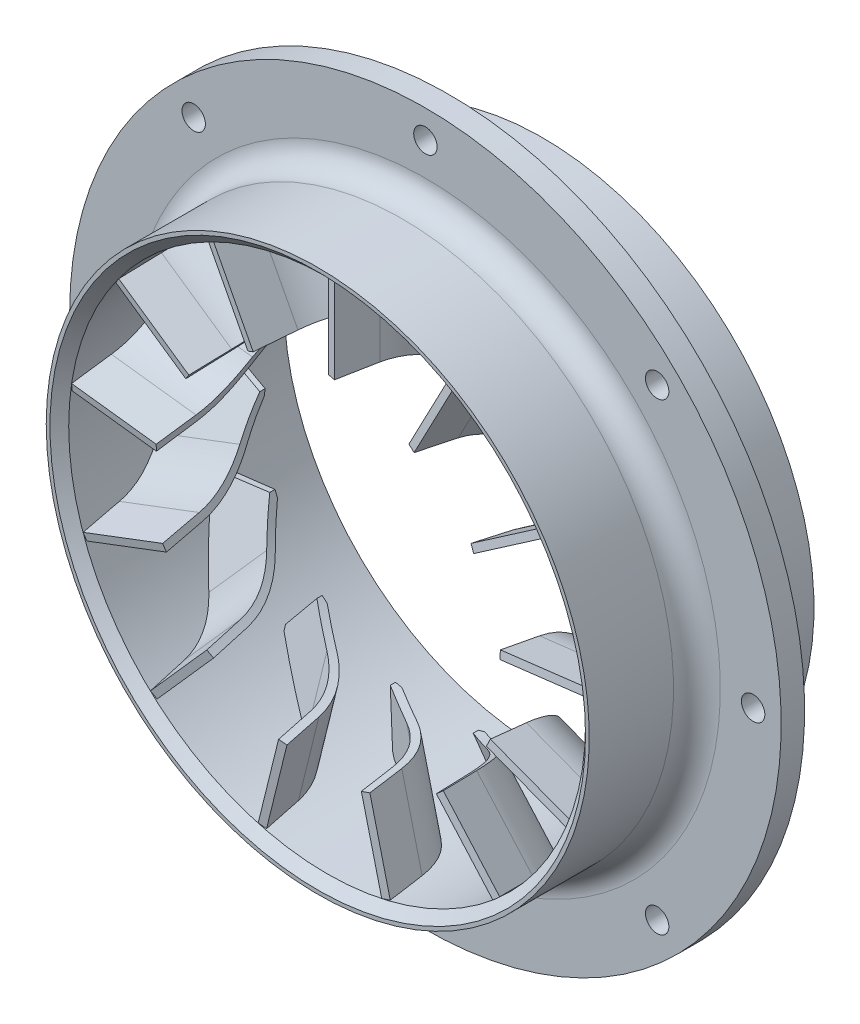
from build123d import *

# Parameters (mm, degrees)
CIRPATTERN1_COUNT = 8
FIN_REACH         = 60.856
FIN_END_RADIUS    = 27.6
FIN_CUT_DEPTH     = 59.855755878
CIRPATTERN5_COUNT = 13
CHAMFER1_SIZE     = 1


with BuildPart() as part:
    # Sketch1 → Revolve1 (revolve)
    with BuildSketch(Plane(origin=(0, 0, 0), x_dir=(0, 0, -1), z_dir=(1, 0, 0)), mode=Mode.PRIVATE) as revolve1_sk:
        with BuildLine():
            Line((-10, 29), (0, 29))
            Line((0, 29), (0, 27.6))
            Line((0, 27.6), (-24, 27.6))
            Line((-24, 27.6), (-24, 29))
            Line((-24, 29), (-15, 29))
            ThreePointArc((-15, 29), (-13.232233047, 29.732233047), (-12.5, 31.5))
            Line((-12.5, 31.5), (-12.5, 38))
            Line((-12.5, 38), (-10, 38))
            Line((-10, 38), (-10, 29))
        make_face()
    revolve(revolve1_sk.sketch.rotate(Axis((0, 0, 0), (0, 0, 1)), 90), axis=Axis((0, 0, 0), (0, 0, 1)))

    # Sketch2 → M3x0.5 Tapped Hole1 (revolve, cut)
    with BuildSketch(Plane(origin=(0, 35, 12.5), x_dir=(0, -1, 0), z_dir=(1, 0, 0))):
        Polygon((0, 0), (0, 8.251075774), (1.25, 7.5), (1.25, 0), align=None)
    m3x0_5_tapped_hole1 = revolve(axis=Axis((0, 35, 18.85), (0, 0, -1)), mode=Mode.SUBTRACT)

    # CirPattern1: M3x0.5 Tapped Hole1 ×8 about axis
    cirpattern1_axis = Axis((0, 0, 0), (0, 0, 1))
    for i in range(1, CIRPATTERN1_COUNT):
        add(m3x0_5_tapped_hole1.rotate(cirpattern1_axis, i * 360 / CIRPATTERN1_COUNT), mode=Mode.SUBTRACT)

    # Chamfer1
    chamfer1_edges = [part.edges().sort_by_distance(p)[0] for p in [
        (27.6, 0, 24),
    ]]
    chamfer(chamfer1_edges, length=CHAMFER1_SIZE)


with BuildPart() as body_2:
    # fin: up to this cylinder (the profile starts inside it)
    fin_end = Plane(origin=(0, 0, 20.835902), z_dir=(0, 0, -1)) * Cylinder(FIN_END_RADIUS, 177.912, mode=Mode.PRIVATE)
    # Sketch4 → fin (new, up to the surface)
    with BuildSketch(Plane(origin=(0, 0, 0), x_dir=(1, 0, 0), z_dir=(0, 1, 0)), mode=Mode.PRIVATE) as fin_sk1:
        with BuildLine():
            Line((0, -22.861081458), (0.725756615, -18.745111161))
            ThreePointArc((0.725756615, -18.745111161), (2.051002285, -15.545685092), (4.604218639, -13.206093352))
            Line((4.604218639, -13.206093352), (12.13, -8.861081458))
            Line((12.13, -8.861081458), (12.53, -9.553901781))
            Line((12.53, -9.553901781), (5.004218639, -13.898913675))
            ThreePointArc((5.004218639, -13.898913675), (2.70632392, -16.004546241), (1.513602817, -18.884029703))
            Line((1.513602817, -18.884029703), (0.787846202, -23))
            Line((0.787846202, -23), (0, -22.861081458))
        make_face()
    fin_tool1 = extrude(fin_sk1.sketch, amount=FIN_REACH, mode=Mode.PRIVATE) & fin_end
    add(fin_tool1.solids().sort_by_distance((0.548929, 0, 20.835902))[0])

    # Sketch5 → fin cut (cut, through all)
    with BuildSketch(Plane.XY):
        with BuildLine():
            Line((0, 18.5), (0, 27.6))
            ThreePointArc((0, 27.6), (-6.605112334, -26.797994161), (12.826359548, 24.438586308))
            Line((12.826359548, 24.438586308), (8.597378683, 16.380936475))
            ThreePointArc((8.597378683, 16.380936475), (4.427339789, 17.962423622), (0, 18.5))
        make_face()
    extrude(amount=FIN_CUT_DEPTH, mode=Mode.SUBTRACT)


with BuildPart() as cirpattern5_1:
    # CirPattern5: pattern copy
    add(body_2.part.rotate(Axis((0, 0, 0), (0, 0, 1)), 1 * 360 / CIRPATTERN5_COUNT))


with BuildPart() as cirpattern5_2:
    # CirPattern5: pattern copy
    add(body_2.part.rotate(Axis((0, 0, 0), (0, 0, 1)), 2 * 360 / CIRPATTERN5_COUNT))


with BuildPart() as cirpattern5_3:
    # CirPattern5: pattern copy
    add(body_2.part.rotate(Axis((0, 0, 0), (0, 0, 1)), 3 * 360 / CIRPATTERN5_COUNT))


with BuildPart() as cirpattern5_4:
    # CirPattern5: pattern copy
    add(body_2.part.rotate(Axis((0, 0, 0), (0, 0, 1)), 4 * 360 / CIRPATTERN5_COUNT))


with BuildPart() as cirpattern5_5:
    # CirPattern5: pattern copy
    add(body_2.part.rotate(Axis((0, 0, 0), (0, 0, 1)), 5 * 360 / CIRPATTERN5_COUNT))


with BuildPart() as cirpattern5_6:
    # CirPattern5: pattern copy
    add(body_2.part.rotate(Axis((0, 0, 0), (0, 0, 1)), 6 * 360 / CIRPATTERN5_COUNT))


with BuildPart() as cirpattern5_7:
    # CirPattern5: pattern copy
    add(body_2.part.rotate(Axis((0, 0, 0), (0, 0, 1)), 7 * 360 / CIRPATTERN5_COUNT))


with BuildPart() as cirpattern5_8:
    # CirPattern5: pattern copy
    add(body_2.part.rotate(Axis((0, 0, 0), (0, 0, 1)), 8 * 360 / CIRPATTERN5_COUNT))


with BuildPart() as cirpattern5_9:
    # CirPattern5: pattern copy
    add(body_2.part.rotate(Axis((0, 0, 0), (0, 0, 1)), 9 * 360 / CIRPATTERN5_COUNT))


with BuildPart() as cirpattern5_10:
    # CirPattern5: pattern copy
    add(body_2.part.rotate(Axis((0, 0, 0), (0, 0, 1)), 10 * 360 / CIRPATTERN5_COUNT))


with BuildPart() as cirpattern5_11:
    # CirPattern5: pattern copy
    add(body_2.part.rotate(Axis((0, 0, 0), (0, 0, 1)), 11 * 360 / CIRPATTERN5_COUNT))


with BuildPart() as cirpattern5_12:
    # CirPattern5: pattern copy
    add(body_2.part.rotate(Axis((0, 0, 0), (0, 0, 1)), 12 * 360 / CIRPATTERN5_COUNT))


with BuildPart() as cut_revolve1_tool:
    # Sketch6 → Cut-Revolve1 (revolve)
    with BuildSketch(Plane(origin=(0, 0, 0), x_dir=(0, 0, -1), z_dir=(1, 0, 0))):
        Polygon((0, 0), (-24, 0), (-24, 18.5), (-11.26, 18.5), (-8.76, 27.6), (0, 27.6), align=None)
    revolve(axis=Axis((0, 0, 0), (0, 0, 1)))


with BuildPart() as body_2_1:
    add(body_2.part)

    # Cut-Revolve1: cut by cut_revolve1_tool
    add(cut_revolve1_tool.part, mode=Mode.SUBTRACT)


with BuildPart() as cirpattern5_1_1:
    add(cirpattern5_1.part)

    # Cut-Revolve1: cut by cut_revolve1_tool
    add(cut_revolve1_tool.part, mode=Mode.SUBTRACT)


with BuildPart() as cirpattern5_2_1:
    add(cirpattern5_2.part)

    # Cut-Revolve1: cut by cut_revolve1_tool
    add(cut_revolve1_tool.part, mode=Mode.SUBTRACT)


with BuildPart() as cirpattern5_3_1:
    add(cirpattern5_3.part)

    # Cut-Revolve1: cut by cut_revolve1_tool
    add(cut_revolve1_tool.part, mode=Mode.SUBTRACT)


with BuildPart() as cirpattern5_4_1:
    add(cirpattern5_4.part)

    # Cut-Revolve1: cut by cut_revolve1_tool
    add(cut_revolve1_tool.part, mode=Mode.SUBTRACT)


with BuildPart() as cirpattern5_5_1:
    add(cirpattern5_5.part)

    # Cut-Revolve1: cut by cut_revolve1_tool
    add(cut_revolve1_tool.part, mode=Mode.SUBTRACT)


with BuildPart() as cirpattern5_6_1:
    add(cirpattern5_6.part)

    # Cut-Revolve1: cut by cut_revolve1_tool
    add(cut_revolve1_tool.part, mode=Mode.SUBTRACT)


with BuildPart() as cirpattern5_7_1:
    add(cirpattern5_7.part)

    # Cut-Revolve1: cut by cut_revolve1_tool
    add(cut_revolve1_tool.part, mode=Mode.SUBTRACT)


with BuildPart() as cirpattern5_8_1:
    add(cirpattern5_8.part)

    # Cut-Revolve1: cut by cut_revolve1_tool
    add(cut_revolve1_tool.part, mode=Mode.SUBTRACT)


with BuildPart() as cirpattern5_9_1:
    add(cirpattern5_9.part)

    # Cut-Revolve1: cut by cut_revolve1_tool
    add(cut_revolve1_tool.part, mode=Mode.SUBTRACT)


with BuildPart() as cirpattern5_10_1:
    add(cirpattern5_10.part)

    # Cut-Revolve1: cut by cut_revolve1_tool
    add(cut_revolve1_tool.part, mode=Mode.SUBTRACT)


with BuildPart() as cirpattern5_11_1:
    add(cirpattern5_11.part)

    # Cut-Revolve1: cut by cut_revolve1_tool
    add(cut_revolve1_tool.part, mode=Mode.SUBTRACT)


with BuildPart() as cirpattern5_12_1:
    add(cirpattern5_12.part)

    # Cut-Revolve1: cut by cut_revolve1_tool
    add(cut_revolve1_tool.part, mode=Mode.SUBTRACT)


solid = Compound([part.part, body_2_1.part, cirpattern5_1_1.part, cirpattern5_2_1.part, cirpattern5_3_1.part, cirpattern5_4_1.part, cirpattern5_5_1.part, cirpattern5_6_1.part, cirpattern5_7_1.part, cirpattern5_8_1.part, cirpattern5_9_1.part, cirpattern5_10_1.part, cirpattern5_11_1.part, cirpattern5_12_1.part])
